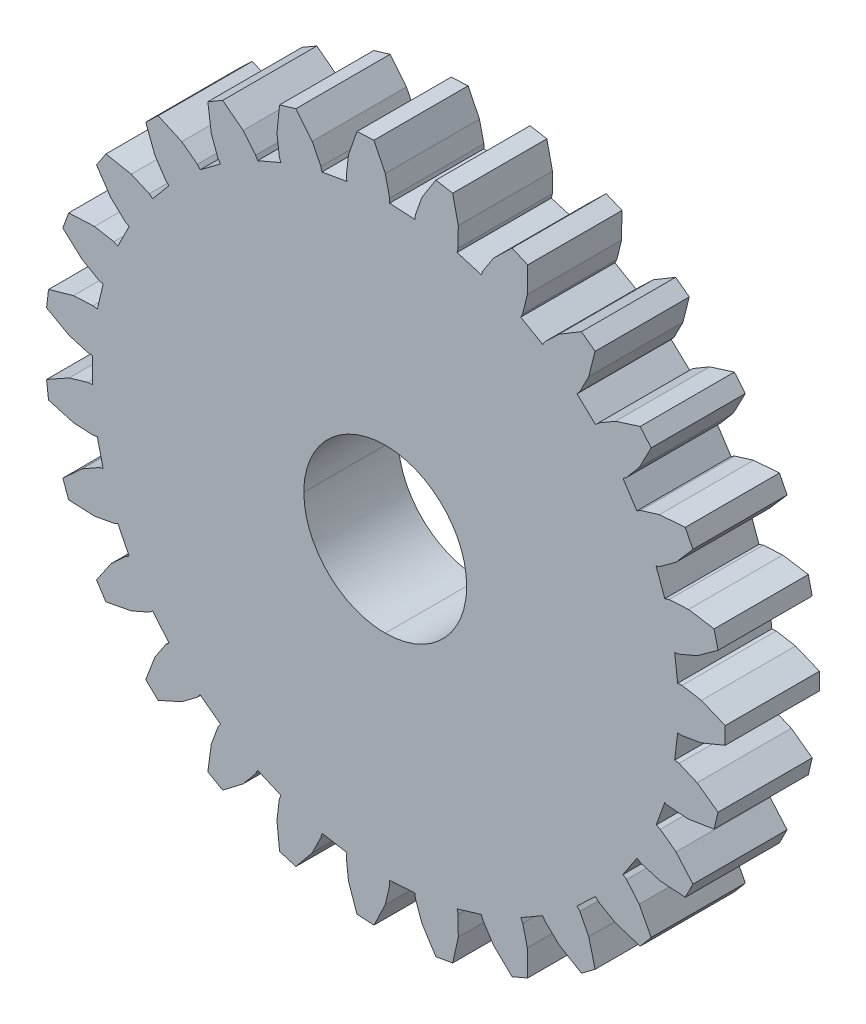
from build123d import *

# Parameters (mm, degrees)
BOSS_EXTRUDE3_DEPTH = 3.175


with BuildPart() as part:
    # planet → Boss-Extrude3 (new body)
    with BuildSketch(Plane(origin=(-36.22540479, 9.012984209, 0), x_dir=(1, 0, 0), z_dir=(0, 0, 1))):
        Polygon((108.229245681, 209.557872837), (108.375719681, 209.568597837), (109.027934681, 209.456837837), (109.833114681, 209.123814837), (109.833114681, 208.548646837), (109.027934681, 208.215623837), (108.375719681, 208.103863837), (108.229245681, 208.114588837), (108.129903681, 207.265381837), (108.274965681, 207.242239837), (108.884001681, 206.982877837), (109.590403681, 206.473466837), (109.457759681, 205.913819837), (108.597828681, 205.775248837), (107.937145681, 205.817017837), (107.797163681, 205.861326837), (107.504781681, 205.057839837), (107.640530681, 205.001677837), (108.173365681, 204.609106837), (108.743172681, 203.950399837), (108.484939681, 203.436472837), (107.616259681, 203.499972837), (106.983234681, 203.693012837), (106.857081681, 203.768366837), (106.387181681, 203.054061837), (106.506279681, 202.967983837), (106.934128681, 202.463088837), (107.336859681, 201.690646837), (106.967148681, 201.250097837), (106.136568681, 201.512563837), (105.565068681, 201.846150837), (105.459516681, 201.948597837), (104.837781681, 201.361857837), (104.933736681, 201.250661837), (105.233739681, 200.660817837), (105.447381681, 199.816126837), (104.986230681, 199.472943837), (104.238341681, 199.919701837), (103.759128681, 200.376054837), (103.680105681, 200.500232837), (102.939836681, 200.072666837), (103.007570681, 199.942279837), (103.163356681, 199.299094837), (103.176621681, 198.428157837), (102.648583681, 198.200403837), (102.024025681, 198.807463837), (101.663063681, 199.362312837), (101.614803681, 199.501166837), (100.795794681, 199.255914837), (100.831636681, 199.113392837), (100.835023681, 198.451581837), (100.646781681, 197.600963837), (100.080361681, 197.501057837), (99.612719681, 198.235963837), (99.389481681, 198.859110837), (99.374523681, 199.005301837), (98.521083681, 198.955630837), (98.523341681, 198.808592837), (98.373763681, 198.163997837), (97.994456681, 197.379701837), (97.420416681, 197.413003837), (97.134808681, 198.235963837), (97.061148681, 198.893823837), (97.080339681, 199.039450837), (96.238470681, 199.187899837), (96.206579681, 199.044530837), (95.912503681, 198.451581837), (95.362734681, 197.775941837), (94.811836681, 197.940759837), (94.723501681, 198.807463837), (94.803652681, 199.464477837), (94.855863681, 199.601919837), (94.071003681, 199.940586837), (94.006939681, 199.808223837), (93.584170681, 199.299094837), (92.893290681, 198.768517837), (92.395168681, 199.056101837), (92.509185681, 199.919701837), (92.738632681, 200.540590837), (92.821323681, 200.661946837), (92.135523681, 201.172486837), (92.042672681, 201.058468837), (91.513788681, 200.660817837), (90.719050681, 200.303806837), (90.300796681, 200.698352837), (90.610959681, 201.512563837), (90.977283681, 202.063743837), (91.085656681, 202.162803837), (90.536170681, 202.817841837), (90.419612681, 202.728377837), (89.813399681, 202.463088837), (88.957701681, 202.299117837), (88.641612681, 202.779459837), (89.131268681, 203.499972837), (89.614996681, 203.951810837), (89.743125681, 204.023494837), (89.359585681, 204.787470837), (89.225530681, 204.727357837), (88.574161681, 204.609106837), (87.704070681, 204.646641837), (87.507361681, 205.187097837), (88.149699681, 205.775248837), (88.724585681, 206.103472837), (88.865979681, 206.143548837), (88.668705681, 206.975539837), (88.524490681, 206.947881837), (87.863525681, 206.982877837), (87.025325681, 207.220226837), (86.958721681, 207.791443837), (87.719592681, 208.215623837), (88.354592681, 208.402454837), (88.501348681, 208.408663837), (88.501348681, 209.263797837), (88.354592681, 209.270006837), (87.719592681, 209.456837837), (86.958721681, 209.881017837), (87.025325681, 210.452234837), (87.863525681, 210.689583837), (88.524490681, 210.724579837), (88.668705681, 210.696921837), (88.865979681, 211.528912837), (88.724585681, 211.568988837), (88.149699681, 211.897212837), (87.507361681, 212.485363837), (87.704070681, 213.025819837), (88.574161681, 213.063354837), (89.225530681, 212.945103837), (89.359585681, 212.884990837), (89.743125681, 213.648966837), (89.614996681, 213.720650837), (89.131268681, 214.172488837), (88.641612681, 214.893001837), (88.957701681, 215.373343837), (89.813399681, 215.209372837), (90.419612681, 214.944083837), (90.536170681, 214.854619837), (91.085656681, 215.509657837), (90.977283681, 215.608717837), (90.610959681, 216.159897837), (90.300796681, 216.974108837), (90.719050681, 217.368654837), (91.513788681, 217.011643837), (92.042672681, 216.613992837), (92.135523681, 216.499974837), (92.821323681, 217.010514837), (92.738632681, 217.131870837), (92.509185681, 217.752759837), (92.395168681, 218.616359837), (92.893290681, 218.903943837), (93.584170681, 218.373366837), (94.006939681, 217.864237837), (94.071003681, 217.731874837), (94.855863681, 218.070541837), (94.803652681, 218.207983837), (94.723501681, 218.864997837), (94.811836681, 219.731701837), (95.362734681, 219.896519837), (95.912503681, 219.220879837), (96.206579681, 218.627930837), (96.238470681, 218.484561837), (97.080339681, 218.633010837), (97.061148681, 218.778637837), (97.134808681, 219.436497837), (97.420416681, 220.259457837), (97.994456681, 220.292759837), (98.373763681, 219.508463837), (98.523341681, 218.863868837), (98.521083681, 218.716830837), (99.374523681, 218.667159837), (99.389481681, 218.813350837), (99.612719681, 219.436497837), (100.080361681, 220.171403837), (100.646781681, 220.071497837), (100.835023681, 219.220879837), (100.831636681, 218.559068837), (100.795794681, 218.416546837), (101.614803681, 218.171294837), (101.663063681, 218.310148837), (102.024025681, 218.864997837), (102.648583681, 219.472057837), (103.176621681, 219.244303837), (103.163356681, 218.373366837), (103.007570681, 217.730181837), (102.939836681, 217.599794837), (103.680105681, 217.172228837), (103.759128681, 217.296406837), (104.238341681, 217.752759837), (104.986230681, 218.199517837), (105.447381681, 217.856334837), (105.233739681, 217.011643837), (104.933736681, 216.421799837), (104.837781681, 216.310603837), (105.459516681, 215.723863837), (105.565068681, 215.826310837), (106.136568681, 216.159897837), (106.967148681, 216.422363837), (107.336859681, 215.981814837), (106.934128681, 215.209372837), (106.506279681, 214.704477837), (106.387181681, 214.618399837), (106.857081681, 213.904094837), (106.983234681, 213.979448837), (107.616259681, 214.172488837), (108.484939681, 214.235988837), (108.743172681, 213.722061837), (108.173365681, 213.063354837), (107.640530681, 212.670783837), (107.504781681, 212.614621837), (107.797163681, 211.811134837), (107.937145681, 211.855443837), (108.597828681, 211.897212837), (109.457759681, 211.758641837), (109.590403681, 211.198994837), (108.884001681, 210.689583837), (108.274965681, 210.430221837), (108.129903681, 210.407079837), align=None)
        with BuildLine():
            add(Edge.make_bspline(
                [(101.117463681, 208.836234837), (101.117463681, 207.320930837), (99.889065681, 206.092535837), (98.373763681, 206.092535837)],
                knots=[0, 0, 0, 0, 1, 1, 1, 1], degree=3))
            add(Edge.make_bspline(
                [(98.373763681, 206.092535837), (96.858458681, 206.092535837), (95.630064681, 207.320930837), (95.630064681, 208.836234837)],
                knots=[0, 0, 0, 0, 1, 1, 1, 1], degree=3))
            add(Edge.make_bspline(
                [(95.630064681, 208.836234837), (95.630064681, 210.351536837), (96.858458681, 211.579934837), (98.373763681, 211.579934837)],
                knots=[0, 0, 0, 0, 1, 1, 1, 1], degree=3))
            add(Edge.make_bspline(
                [(98.373763681, 211.579934837), (99.889065681, 211.579934837), (101.117463681, 210.351536837), (101.117463681, 208.836234837)],
                knots=[0, 0, 0, 0, 1, 1, 1, 1], degree=3))
        make_face(mode=Mode.SUBTRACT)
    extrude(amount=BOSS_EXTRUDE3_DEPTH)


solid = part.part
